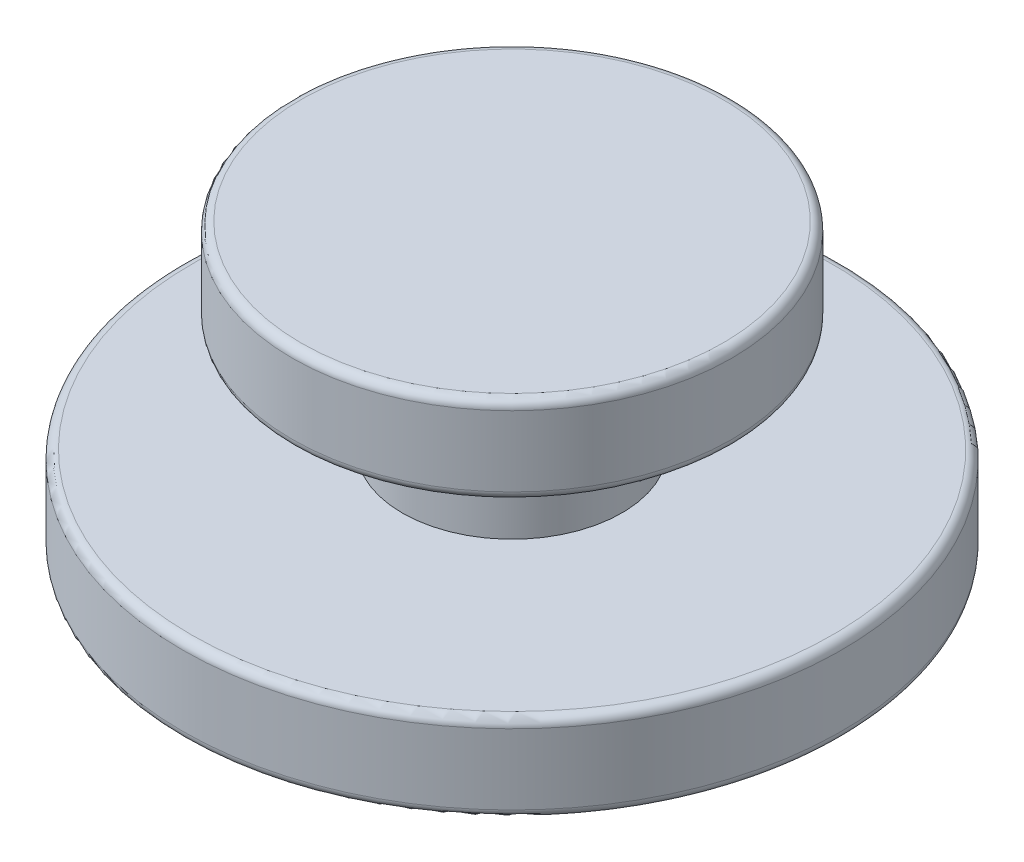
from build123d import *

# Parameters (mm, degrees)
SKETCH1_R           = 7.5
BOSS_EXTRUDE1_DEPTH = 2
SKETCH2_R           = 2.5
BOSS_EXTRUDE2_DEPTH = 2.5
SKETCH3_R           = 5
BOSS_EXTRUDE3_DEPTH = 2
FILLET1_R           = 0.2


with BuildPart() as part:
    # Sketch1 → Boss-Extrude1 (new body)
    with BuildSketch(Plane(origin=(0, 0, 0), x_dir=(1, 0, 0), z_dir=(0, 1, 0))):
        with Locations(Location((0, 0, 0), (0, 0, 270))):
            Circle(SKETCH1_R)
    extrude(amount=BOSS_EXTRUDE1_DEPTH)

    # Sketch2 → Boss-Extrude2 (add)
    with BuildSketch(Plane(origin=(0, 2, 0), x_dir=(1, 0, 0), z_dir=(0, 1, 0))):
        with Locations(Location((0, 0, 0), (0, 0, 270))):
            Circle(SKETCH2_R)
    extrude(amount=BOSS_EXTRUDE2_DEPTH)

    # Sketch3 → Boss-Extrude3 (add)
    with BuildSketch(Plane(origin=(0, 4.5, 0), x_dir=(1, 0, 0), z_dir=(0, 1, 0))):
        with Locations(Location((0, 0, 0), (0, 0, 270))):
            Circle(SKETCH3_R)
    extrude(amount=BOSS_EXTRUDE3_DEPTH)

    # Fillet1
    fillet1_edges = [part.edges().sort_by_distance(p)[0] for p in [
        (0, 6.5, -5),
        (0, 0, -7.5),
        (0, 2, -7.5),
        (0, 4.5, -5),
    ]]
    fillet(fillet1_edges, radius=FILLET1_R)


solid = part.part
